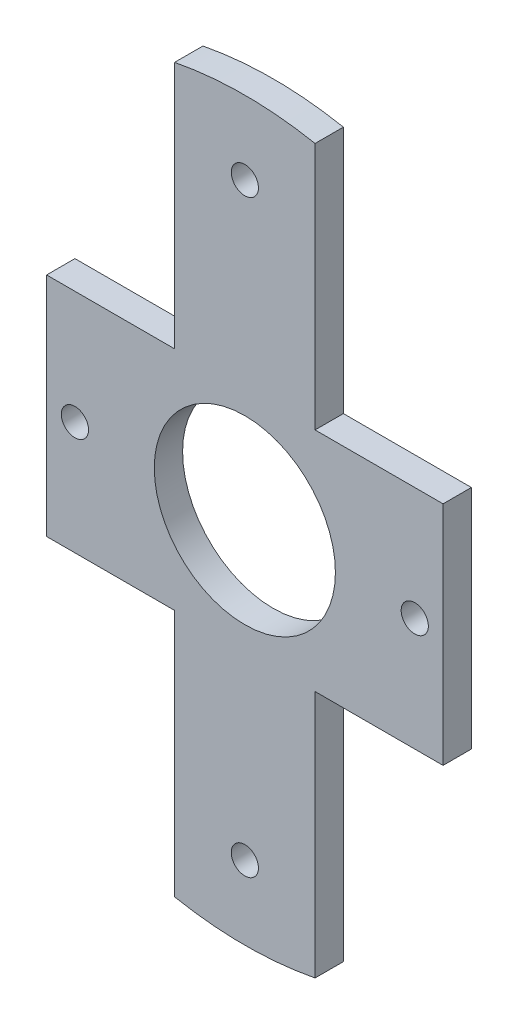
from build123d import *

# Parameters (mm, degrees)
SKETCH1_R           = 15.99
SKETCH1_R_2         = 2.4
BOSS_EXTRUDE1_DEPTH = 5


with BuildPart() as part:
    # Sketch1 → Boss-Extrude1 (new body)
    with BuildSketch(Plane.XY):
        with BuildLine():
            Line((12.4, 20), (35, 20))
            Line((35, 20), (35, 0))
            Line((35, 0), (35, -20))
            Line((35, -20), (12.4, -20))
            Line((12.4, -20), (12.4, -63.806269284))
            ThreePointArc((12.4, -63.806269284), (0, -65), (-12.4, -63.806269284))
            Line((-12.4, -63.806269284), (-12.4, -20))
            Line((-12.4, -20), (-35, -20))
            Line((-35, -20), (-35, 20))
            Line((-35, 20), (-12.4, 20))
            Line((-12.4, 20), (-12.4, 63.806269284))
            ThreePointArc((-12.4, 63.806269284), (0, 65), (12.4, 63.806269284))
            Line((12.4, 63.806269284), (12.4, 20))
        make_face()
        Circle(SKETCH1_R, mode=Mode.SUBTRACT)
        with Locations((0, 52)):
            Circle(SKETCH1_R_2, mode=Mode.SUBTRACT)
        with Locations((30, 0)):
            Circle(SKETCH1_R_2, mode=Mode.SUBTRACT)
        with Locations(Location((0, -52, 0), (0, 0, 180))):
            Circle(SKETCH1_R_2, mode=Mode.SUBTRACT)
        with Locations(Location((-30, 0, 0), (0, 0, 180))):
            Circle(SKETCH1_R_2, mode=Mode.SUBTRACT)
    extrude(amount=BOSS_EXTRUDE1_DEPTH)


solid = part.part
